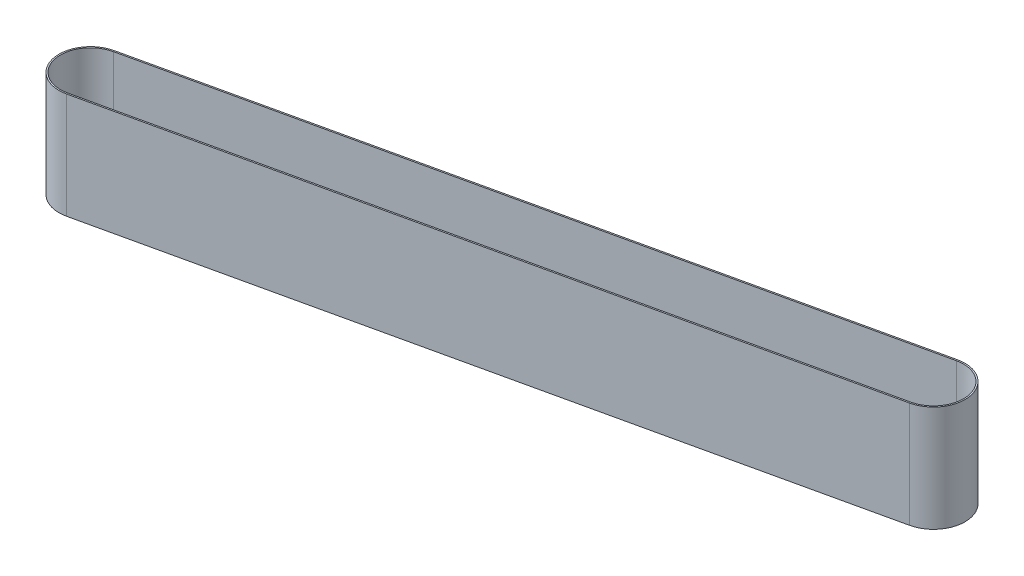
from build123d import *

# Parameters (mm, degrees)
EXTRUDE_1_DEPTH = 150


with BuildPart() as part:
    # 草图1 → 凸台-拉伸1 (new body)
    with BuildSketch(Plane(origin=(0, 0, 0), x_dir=(1, 0, 0), z_dir=(0, 1, 0))):
        with BuildLine():
            Line((-153.204283988, -18.669843342), (822.774463813, 199.195903942))
            ThreePointArc((822.774463813, 199.195903942), (875.994800528, 165.400020708), (842.198917294, 112.179683993))
            Line((842.198917294, 112.179683993), (-133.779830508, -105.68606329))
            ThreePointArc((-133.779830508, -105.68606329), (-187.000167222, -71.890180056), (-153.204283988, -18.669843342))
        make_face()
        with BuildLine():
            Line((-152.768552494, -20.621800837), (823.210195308, 197.243946446))
            ThreePointArc((823.210195308, 197.243946446), (874.042843032, 164.964289214), (841.7631858, 114.131641489))
            Line((841.7631858, 114.131641489), (-134.215562002, -103.734105795))
            ThreePointArc((-134.215562002, -103.734105795), (-185.048209727, -71.454448562), (-152.768552494, -20.621800837))
        make_face(mode=Mode.SUBTRACT)
    extrude(amount=EXTRUDE_1_DEPTH)


solid = part.part
